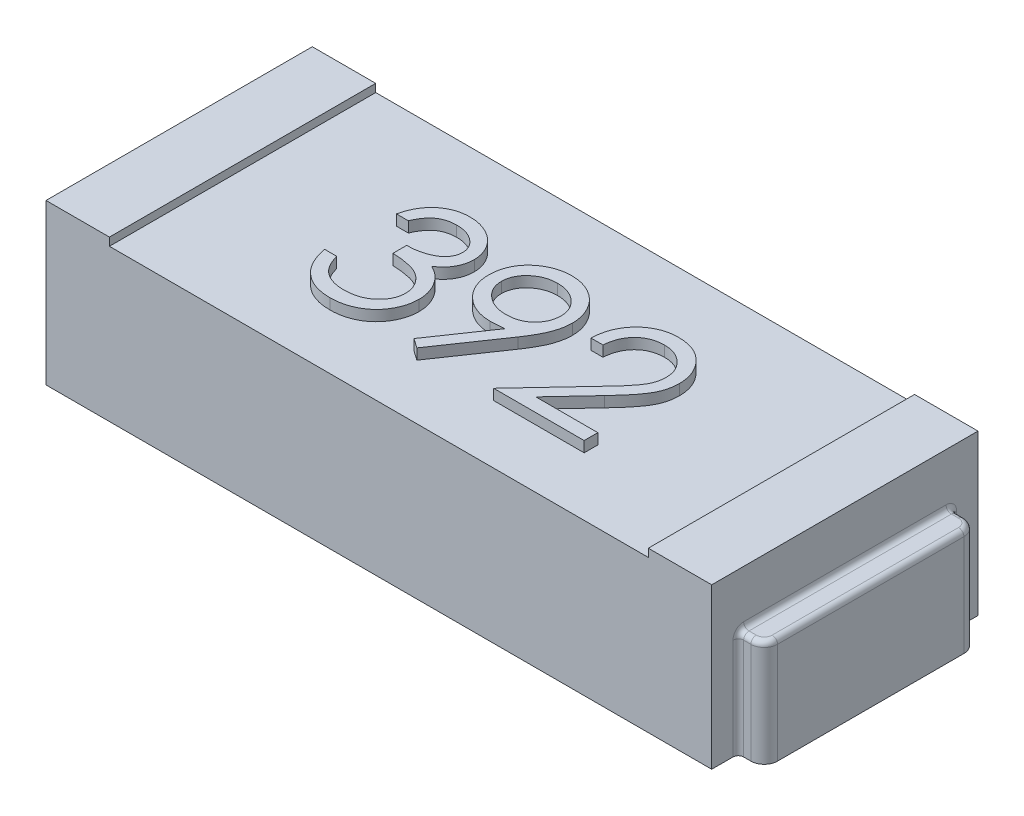
from build123d import *

# Parameters (mm, degrees)
ESQUISSE1_W             = 2.5
ESQUISSE1_H             = 1
BOSS_EXTRU_1_DEPTH      = 0.6
ESQUISSE2_W             = 2.023603034
ESQUISSE2_H             = 1
ENL_V_MAT_EXTRU_1_DEPTH = 0.03
BOSS_EXTRU_2_DEPTH      = 0.4
CONG_1_R                = 0.02
CONG_1_OF_SYM_TRIE2_R   = 0.02
BOSS_EXTRU_3_DEPTH      = 0.04


with BuildPart() as part:
    # Esquisse1 → Boss.-Extru.1 (new body)
    with BuildSketch(Plane(origin=(0, 0, 0), x_dir=(1, 0, 0), z_dir=(0, 1, 0))):
        Rectangle(ESQUISSE1_W, ESQUISSE1_H)
    extrude(amount=BOSS_EXTRU_1_DEPTH)

    # Esquisse2 → Enlèv. mat.-Extru.1 (cut)
    with BuildSketch(Plane(origin=(0, 0.6, 0), x_dir=(1, 0, 0), z_dir=(0, 1, 0))):
        Rectangle(ESQUISSE2_W, ESQUISSE2_H)
    extrude(amount=-ENL_V_MAT_EXTRU_1_DEPTH, mode=Mode.SUBTRACT)

    # Esquisse3 → Boss.-Extru.2 (add)
    with BuildSketch(Plane(origin=(0, 0, 0), x_dir=(1, 0, 0), z_dir=(0, 1, 0))):
        with BuildLine():
            Line((1.25, 0.4), (1.297141448, 0.4))
            ThreePointArc((1.297141448, 0.4), (1.332496787, 0.385355339), (1.347141448, 0.35))
            Line((1.347141448, 0.35), (1.347141448, -0.35))
            ThreePointArc((1.347141448, -0.35), (1.332496787, -0.385355339), (1.297141448, -0.4))
            Line((1.297141448, -0.4), (1.25, -0.4))
            Line((1.25, -0.4), (1.25, 0.4))
        make_face()
    boss_extru_2 = extrude(amount=BOSS_EXTRU_2_DEPTH)

    # Congé1
    cong_1_edges = [part.edges().sort_by_distance(p)[0] for p in [
        (1.25, 0.2, -0.4),
        (1.25, 0.2, 0.4),
        (1.25, 0.4, 0),
        (1.273570724, 0.4, 0.4),
        (1.332496787, 0.4, 0.385355339),
        (1.347141448, 0.4, 0),
        (1.332496787, 0.4, -0.385355339),
        (1.273570724, 0.4, -0.4),
    ]]
    fillet(cong_1_edges, radius=CONG_1_R)

    # Symétrie2: Boss.-Extru.2 across plane
    add(boss_extru_2.mirror(Plane(origin=(0, 0, 0), x_dir=(0, 0, 1), z_dir=(1, 0, 0))))

    # Congé1 of Symétrie2
    cong_1_of_sym_trie2_edges = [part.edges().sort_by_distance(p)[0] for p in [
        (-1.25, 0.2, -0.4),
        (-1.25, 0.2, 0.4),
        (-1.25, 0.4, 0),
        (-1.273570724, 0.4, 0.4),
        (-1.332496787, 0.4, 0.385355339),
        (-1.347141448, 0.4, 0),
        (-1.332496787, 0.4, -0.385355339),
        (-1.273570724, 0.4, -0.4),
    ]]
    fillet(cong_1_of_sym_trie2_edges, radius=CONG_1_OF_SYM_TRIE2_R)

    # Esquisse4 → Boss.-Extru.3 (add)
    # profile 1 of 3: a face of its own
    with BuildSketch(Plane(origin=(0, 0.57, 0), x_dir=(1, 0, 0), z_dir=(0, 1, 0))):
        with BuildLine():
            Line((0.275641026, 0.065854324), (0.230769231, 0.065854324))
            add(Edge.make_bspline(
                [(0.230769231, 0.065854324), (0.231061681, 0.071807307), (0.231636046, 0.08349881), (0.234325802, 0.100545082), (0.238174498, 0.116838625), (0.243616135, 0.132248612), (0.250374174, 0.146911299), (0.258478464, 0.160768444), (0.268077586, 0.173767185), (0.278964262, 0.18578702), (0.290788353, 0.196813816), (0.303546344, 0.206335994), (0.316952777, 0.214381375), (0.330966977, 0.221107267), (0.345747057, 0.226155816), (0.361158894, 0.229901765), (0.377270199, 0.232155528), (0.388247345, 0.232397784), (0.393830128, 0.23252099)],
                knots=[0, 0, 0, 0, 1.10065271, 2.161652631, 3.183658789, 4.190468796, 5.17591951, 6.163126047, 7.15150782, 8.156236427, 9.156009102, 10.134482811, 11.092018607, 12.041330605, 13.001268258, 13.972401359, 14.968799086, 16, 16, 16, 16], degree=3))
            add(Edge.make_bspline(
                [(0.393830128, 0.23252099), (0.39931271, 0.232392639), (0.410085788, 0.232140434), (0.425808933, 0.229974573), (0.440777118, 0.226582346), (0.454961085, 0.221823), (0.468247665, 0.215425225), (0.480736672, 0.207739862), (0.492576787, 0.198851315), (0.503234899, 0.188386485), (0.513021768, 0.177214715), (0.521464947, 0.165287872), (0.528695399, 0.152969403), (0.53472221, 0.140165374), (0.539158802, 0.126755227), (0.542527117, 0.112934198), (0.544431033, 0.098559225), (0.544723237, 0.088829717), (0.544871795, 0.08388317)],
                knots=[0, 0, 0, 0, 1.111607364, 2.184268762, 3.212621178, 4.221274766, 5.211760367, 6.196651075, 7.1921475, 8.207485113, 9.220403448, 10.201281604, 11.166441695, 12.114753415, 13.065576456, 14.026450734, 14.996634279, 16, 16, 16, 16], degree=3))
            add(Edge.make_bspline(
                [(0.544871795, 0.08388317), (0.5446299, 0.076919193), (0.544150356, 0.063113449), (0.540048302, 0.042825611), (0.533641657, 0.023169408), (0.525927749, 0.007349794), (0.518145972, -0.005397848), (0.511133471, -0.015893378), (0.502924212, -0.027194159), (0.493398712, -0.03926235), (0.482754016, -0.052192479), (0.470893707, -0.065976736), (0.45773321, -0.080472703), (0.448496281, -0.090373503), (0.443709936, -0.09550385)],
                knots=[0, 0, 0, 0, 1.184426356, 2.348067706, 3.509069118, 4.696110526, 5.333549288, 6.050745305, 6.844228056, 7.710549037, 8.667450064, 9.695053472, 10.805634456, 12, 12, 12, 12], degree=3))
            Line((0.443709936, -0.09550385), (0.318609776, -0.229017471))
            Line((0.318609776, -0.229017471), (0.551282051, -0.229017471))
            Line((0.551282051, -0.229017471), (0.551282051, -0.280299523))
            Line((0.551282051, -0.280299523), (0.211538462, -0.280299523))
            Line((0.211538462, -0.280299523), (0.405448718, -0.073368433))
            add(Edge.make_bspline(
                [(0.405448718, -0.073368433), (0.410169845, -0.068440103), (0.419238163, -0.058973791), (0.432064245, -0.045153368), (0.443584101, -0.032332005), (0.4538723, -0.020533927), (0.462705658, -0.00958656), (0.470544548, 0.000155541), (0.476825347, 0.009120462), (0.483641832, 0.019511978), (0.490243829, 0.032199452), (0.495917023, 0.047704265), (0.499376287, 0.063665301), (0.499791263, 0.074451306), (0.5, 0.079876759)],
                knots=[0, 0, 0, 0, 1.329631726, 2.553950428, 3.673215718, 4.687767853, 5.603093632, 6.413772471, 7.123043292, 7.734684054, 8.834405432, 9.900288307, 10.943827018, 12, 12, 12, 12], degree=3))
            add(Edge.make_bspline(
                [(0.5, 0.079876759), (0.49990918, 0.083288388), (0.49973019, 0.090012052), (0.498150519, 0.099870018), (0.495763304, 0.109379277), (0.492342553, 0.11856908), (0.487827304, 0.12734703), (0.482331107, 0.135723813), (0.47598967, 0.143822236), (0.468653774, 0.151415565), (0.460594985, 0.158370023), (0.452081521, 0.164530606), (0.443074363, 0.169679051), (0.433611489, 0.17389955), (0.423719279, 0.177210319), (0.413378601, 0.179504402), (0.402618027, 0.180944757), (0.395270385, 0.181139638), (0.391526442, 0.181238939)],
                knots=[0, 0, 0, 0, 0.991446411, 1.95395049, 2.89581595, 3.838931463, 4.798493298, 5.75982156, 6.748411868, 7.785213223, 8.824556874, 9.840280684, 10.836137867, 11.835679398, 12.848801643, 13.863922112, 14.911575587, 16, 16, 16, 16], degree=3))
            add(Edge.make_bspline(
                [(0.391526442, 0.181238939), (0.387616323, 0.181136791), (0.379937495, 0.180936191), (0.368663348, 0.179532953), (0.357908237, 0.177112119), (0.347645108, 0.173801165), (0.337856595, 0.169592801), (0.328590303, 0.164351123), (0.319867034, 0.158096338), (0.311670387, 0.15100483), (0.30411839, 0.143109459), (0.297483122, 0.134308036), (0.291685406, 0.124761262), (0.286626944, 0.114494898), (0.282518988, 0.103415786), (0.279379967, 0.091563257), (0.276896132, 0.078988774), (0.276066343, 0.07030519), (0.275641026, 0.065854324)],
                knots=[0, 0, 0, 0, 1.031018746, 2.02475058, 2.990194455, 3.934040569, 4.864654155, 5.795059489, 6.735614925, 7.690564532, 8.649604399, 9.611025574, 10.590972636, 11.591080095, 12.624614302, 13.701020113, 14.821632451, 16, 16, 16, 16], degree=3))
        make_face()
    # profile 2 of 3: a face of its own
    with BuildSketch(Plane(origin=(0, 0.57, 0), x_dir=(1, 0, 0), z_dir=(0, 1, 0))):
        with BuildLine():
            Line((-0.064102564, -0.293120035), (-0.099959936, -0.268180132))
            Line((-0.099959936, -0.268180132), (0.0390625, -0.064954971))
            add(Edge.make_bspline(
                [(0.0390625, -0.064954971), (0.030192395, -0.066039695), (0.012726663, -0.068175575), (-0.004864351, -0.068567955), (-0.013521635, -0.068761061)],
                knots=[0, 0, 0, 0, 1.015715272, 2, 2, 2, 2], degree=3))
            add(Edge.make_bspline(
                [(-0.013521635, -0.068761061), (-0.018770499, -0.068626622), (-0.02907356, -0.068362729), (-0.044220938, -0.066271042), (-0.058776019, -0.063049595), (-0.072700212, -0.05824263), (-0.086045856, -0.0522686), (-0.098783815, -0.044860455), (-0.110896942, -0.036145271), (-0.122255144, -0.026169129), (-0.132585392, -0.015215122), (-0.14178872, -0.003621458), (-0.149437453, 0.008746538), (-0.155791251, 0.021636569), (-0.160609887, 0.035233905), (-0.164118821, 0.049383819), (-0.166279158, 0.064185482), (-0.166536171, 0.074260501), (-0.166666667, 0.079375958)],
                knots=[0, 0, 0, 0, 1.060718605, 2.082097864, 3.085795603, 4.069760067, 5.054557537, 6.03741023, 7.043284206, 8.066802108, 9.088538119, 10.083643548, 11.053783639, 12.022749082, 12.983451788, 13.964007469, 14.966251758, 16, 16, 16, 16], degree=3))
            add(Edge.make_bspline(
                [(-0.166666667, 0.079375958), (-0.16641889, 0.08637148), (-0.165932555, 0.10010227), (-0.162018482, 0.120164237), (-0.15558129, 0.139133743), (-0.146605808, 0.156960914), (-0.135300848, 0.173389305), (-0.121713906, 0.188190535), (-0.105927626, 0.201154086), (-0.088301623, 0.212297525), (-0.069251191, 0.221259668), (-0.049298526, 0.227865282), (-0.028596509, 0.231750818), (-0.014572556, 0.232263083), (-0.007512019, 0.23252099)],
                knots=[0, 0, 0, 0, 1.022988612, 2.007919123, 2.978103895, 3.94594894, 4.918897164, 5.887013414, 6.875921846, 7.89917871, 8.930658928, 9.948724884, 10.967259574, 12, 12, 12, 12], degree=3))
            add(Edge.make_bspline(
                [(-0.007512019, 0.23252099), (-0.000585102, 0.232259538), (0.013101833, 0.231742934), (0.033228834, 0.22795951), (0.052506122, 0.221582842), (0.070826835, 0.212770762), (0.087789608, 0.201724918), (0.103043295, 0.188562843), (0.116239801, 0.173276339), (0.127357498, 0.156235126), (0.136281789, 0.137925558), (0.142720687, 0.118813569), (0.14668435, 0.099036608), (0.147183825, 0.085637398), (0.147435897, 0.078875157)],
                knots=[0, 0, 0, 0, 1.026385292, 2.028040595, 3.023318987, 4.028184125, 5.03290303, 6.015178782, 7.004435299, 8.016004309, 9.023023918, 10.015172535, 10.998308025, 12, 12, 12, 12], degree=3))
            add(Edge.make_bspline(
                [(0.147435897, 0.078875157), (0.147267553, 0.073626047), (0.146926109, 0.062979541), (0.144535208, 0.046803778), (0.140475182, 0.030310745), (0.135867796, 0.016350517), (0.131420344, 0.004820739), (0.127234468, -0.00428663), (0.122589874, -0.013872524), (0.117172908, -0.02383643), (0.111349723, -0.034305363), (0.104769826, -0.045174323), (0.097583316, -0.056457893), (0.092464784, -0.06406462), (0.08984375, -0.067959779)],
                knots=[0, 0, 0, 0, 1.179839688, 2.393009684, 3.667231171, 4.993948276, 5.694988576, 6.444077775, 7.246288328, 8.089075292, 8.993003841, 9.939041771, 10.944649915, 12, 12, 12, 12], degree=3))
            Line((0.08984375, -0.067959779), (-0.064102564, -0.293120035))
        make_face()
        with BuildLine():
            add(Edge.make_bspline(
                [(-0.005208333, -0.01747901), (-0.001232046, -0.017370384), (0.006508435, -0.017158925), (0.017848049, -0.015871891), (0.028551507, -0.013589893), (0.038647399, -0.010315648), (0.048236957, -0.006364695), (0.057167861, -0.001334412), (0.065447586, 0.004667965), (0.073131575, 0.011412253), (0.079955004, 0.018905193), (0.08603258, 0.026747637), (0.091198375, 0.03497401), (0.095278843, 0.043687333), (0.098633783, 0.052675506), (0.100950641, 0.062083271), (0.102234118, 0.071861614), (0.102452914, 0.078504279), (0.102564103, 0.081879965)],
                knots=[0, 0, 0, 0, 1.163407946, 2.26475976, 3.333800367, 4.359385343, 5.366239384, 6.363380779, 7.350133999, 8.353570782, 9.349036268, 10.310270964, 11.253520213, 12.184142, 13.120487599, 14.056272588, 15.012232024, 16, 16, 16, 16], degree=3))
            add(Edge.make_bspline(
                [(0.102564103, 0.081879965), (0.102468436, 0.08525706), (0.102279912, 0.09191204), (0.100767441, 0.10170486), (0.098106694, 0.111089611), (0.094536625, 0.120117673), (0.089833734, 0.128714869), (0.084190379, 0.136989136), (0.077485743, 0.144888011), (0.069771091, 0.152225723), (0.061451869, 0.158989709), (0.052586083, 0.164959148), (0.04324681, 0.169962176), (0.033491025, 0.174090601), (0.023298404, 0.177312283), (0.012674977, 0.179629049), (0.001567062, 0.180910728), (-0.005973122, 0.181128142), (-0.009815705, 0.181238939)],
                knots=[0, 0, 0, 0, 0.972161553, 1.915763587, 2.844109794, 3.775983486, 4.705125789, 5.659731448, 6.655561913, 7.682237399, 8.721216875, 9.739758359, 10.754845918, 11.767244016, 12.7857855, 13.828538656, 14.893392813, 16, 16, 16, 16], degree=3))
            add(Edge.make_bspline(
                [(-0.009815705, 0.181238939), (-0.01362487, 0.181127963), (-0.02109842, 0.180910229), (-0.032107585, 0.179631485), (-0.042659181, 0.177296702), (-0.052822269, 0.174092093), (-0.062577764, 0.169961868), (-0.071916597, 0.164958886), (-0.080784457, 0.158991083), (-0.089095702, 0.152220401), (-0.096823977, 0.144922166), (-0.103413338, 0.136954533), (-0.109069609, 0.128719173), (-0.113766038, 0.120116529), (-0.117337826, 0.111089916), (-0.119998112, 0.101704777), (-0.121510707, 0.091912061), (-0.121699213, 0.085257067), (-0.121794872, 0.081879965)],
                knots=[0, 0, 0, 0, 1.099389452, 2.15699305, 3.192601482, 4.213358962, 5.227959689, 6.245255729, 7.266013209, 8.307253147, 9.336162325, 10.327954924, 11.284637477, 12.215801273, 13.149702402, 14.080068371, 15.025723358, 16, 16, 16, 16], degree=3))
            add(Edge.make_bspline(
                [(-0.121794872, 0.081879965), (-0.121708311, 0.07850165), (-0.121537597, 0.071838997), (-0.11989077, 0.062049512), (-0.11713673, 0.052665484), (-0.113448246, 0.043595669), (-0.108590876, 0.034928261), (-0.102630326, 0.026704352), (-0.095643819, 0.018830716), (-0.08772475, 0.011429686), (-0.079057869, 0.004636518), (-0.069801191, -0.001296394), (-0.060114072, -0.006306743), (-0.04996241, -0.010326941), (-0.039421439, -0.013557178), (-0.02839642, -0.015867685), (-0.016923815, -0.01714658), (-0.00915096, -0.017367137), (-0.005208333, -0.01747901)],
                knots=[0, 0, 0, 0, 0.952633368, 1.87876736, 2.791047057, 3.707742249, 4.635551637, 5.587206343, 6.568248508, 7.601284464, 8.641511608, 9.671105535, 10.699146789, 11.713763218, 12.747829548, 13.806491675, 14.887386225, 16, 16, 16, 16], degree=3))
        make_face(mode=Mode.SUBTRACT)
    # profile 3 of 3: a face of its own
    with BuildSketch(Plane(origin=(0, 0.57, 0), x_dir=(1, 0, 0), z_dir=(0, 1, 0))):
        with BuildLine():
            Line((-0.493589744, 0.104315862), (-0.538461538, 0.104315862))
            add(Edge.make_bspline(
                [(-0.538461538, 0.104315862), (-0.537245888, 0.109349074), (-0.534869392, 0.119188592), (-0.529912596, 0.133246772), (-0.524512702, 0.146550132), (-0.518028544, 0.158849571), (-0.510955865, 0.170392272), (-0.502852619, 0.180916432), (-0.494092659, 0.190689713), (-0.48440338, 0.199363033), (-0.474242143, 0.207216994), (-0.463465769, 0.213913431), (-0.45229107, 0.219674024), (-0.440640622, 0.224419771), (-0.42847974, 0.227994846), (-0.415918366, 0.230588676), (-0.40292358, 0.23227312), (-0.394102495, 0.232437515), (-0.389623397, 0.23252099)],
                knots=[0, 0, 0, 0, 1.162005537, 2.271625781, 3.343758855, 4.383309926, 5.390229558, 6.379919256, 7.361854164, 8.333198761, 9.295911338, 10.242430842, 11.177959212, 12.116337295, 13.062827104, 14.020064771, 14.994644689, 16, 16, 16, 16], degree=3))
            add(Edge.make_bspline(
                [(-0.389623397, 0.23252099), (-0.383097291, 0.232323957), (-0.370187433, 0.231934189), (-0.351221283, 0.228374984), (-0.332931738, 0.222742822), (-0.315518988, 0.214960861), (-0.299344926, 0.205362674), (-0.284954042, 0.19393914), (-0.272541398, 0.180910668), (-0.262127915, 0.166520302), (-0.253974344, 0.151140943), (-0.247962005, 0.13531235), (-0.244301765, 0.119072068), (-0.2438274, 0.108106742), (-0.243589744, 0.102613138)],
                knots=[0, 0, 0, 0, 1.083050992, 2.142477498, 3.193116406, 4.255571735, 5.30263384, 6.308962982, 7.297363603, 8.282367274, 9.249857812, 10.179914175, 11.08814088, 12, 12, 12, 12], degree=3))
            add(Edge.make_bspline(
                [(-0.243589744, 0.102613138), (-0.243755971, 0.097326453), (-0.244081252, 0.086981231), (-0.24684321, 0.07187816), (-0.251491247, 0.057643645), (-0.257929785, 0.044217765), (-0.266264292, 0.031685645), (-0.276360392, 0.020019089), (-0.288289343, 0.009166352), (-0.297329192, 0.002949285), (-0.301983173, -0.000251446)],
                knots=[0, 0, 0, 0, 1.024540389, 2.004866551, 2.965041327, 3.920577974, 4.882998113, 5.874504559, 6.905732034, 8, 8, 8, 8], degree=3))
            add(Edge.make_bspline(
                [(-0.301983173, -0.000251446), (-0.296664351, -0.002819756), (-0.286126226, -0.007908321), (-0.271761865, -0.017887715), (-0.258722168, -0.029410051), (-0.251450208, -0.038401858), (-0.247796474, -0.042919715)],
                knots=[0, 0, 0, 0, 1.015518401, 2.012035669, 3.001164323, 4, 4, 4, 4], degree=3))
            add(Edge.make_bspline(
                [(-0.247796474, -0.042919715), (-0.245390568, -0.046213679), (-0.240618155, -0.052747668), (-0.234727364, -0.063252871), (-0.229383205, -0.073874513), (-0.225218888, -0.084897285), (-0.22199405, -0.09619343), (-0.219688902, -0.107782343), (-0.218256882, -0.119673489), (-0.218051803, -0.127718129), (-0.217948718, -0.131761862)],
                knots=[0, 0, 0, 0, 1.025084078, 2.033381695, 3.024893161, 4.013698104, 4.991890475, 5.976764909, 6.982997093, 8, 8, 8, 8], degree=3))
            add(Edge.make_bspline(
                [(-0.217948718, -0.131761862), (-0.218205077, -0.138763251), (-0.218716589, -0.15273308), (-0.223288599, -0.173372326), (-0.230376205, -0.193547398), (-0.240441482, -0.212843803), (-0.252708269, -0.230898143), (-0.267302172, -0.247051902), (-0.284057373, -0.260937417), (-0.302743895, -0.272538878), (-0.322989199, -0.281812867), (-0.344642855, -0.288249644), (-0.367392862, -0.29244193), (-0.382993905, -0.292891483), (-0.390925481, -0.293120035)],
                knots=[0, 0, 0, 0, 0.955779014, 1.907060117, 2.875433937, 3.871313158, 4.872415639, 5.851225146, 6.836215519, 7.83643374, 8.849228613, 9.86973379, 10.916971861, 12, 12, 12, 12], degree=3))
            add(Edge.make_bspline(
                [(-0.390925481, -0.293120035), (-0.396271095, -0.292996005), (-0.406789482, -0.292751954), (-0.422252838, -0.291083583), (-0.437013081, -0.288036439), (-0.451090167, -0.283935967), (-0.4644966, -0.278737147), (-0.477191473, -0.272263047), (-0.489252886, -0.264647118), (-0.500567022, -0.255799463), (-0.511132531, -0.245902128), (-0.520668635, -0.234779413), (-0.52933432, -0.222636926), (-0.536897554, -0.209333633), (-0.543702833, -0.195041453), (-0.549300112, -0.179577382), (-0.554226622, -0.163079664), (-0.556517117, -0.151582844), (-0.557692308, -0.145684138)],
                knots=[0, 0, 0, 0, 1.048658725, 2.063410685, 3.046034179, 4.001477787, 4.936774919, 5.862367409, 6.792675028, 7.730719943, 8.675894397, 9.627829632, 10.600096036, 11.597688215, 12.626045268, 13.701542398, 14.82072376, 16, 16, 16, 16], degree=3))
            Line((-0.557692308, -0.145684138), (-0.512820513, -0.145684138))
            add(Edge.make_bspline(
                [(-0.512820513, -0.145684138), (-0.511651471, -0.149533997), (-0.509377584, -0.157022307), (-0.50550697, -0.167799494), (-0.501097217, -0.177679216), (-0.496366565, -0.186733947), (-0.491398216, -0.195052862), (-0.485838941, -0.202415986), (-0.480100492, -0.209146729), (-0.47577487, -0.212938817), (-0.473657853, -0.214794715)],
                knots=[0, 0, 0, 0, 1.198163088, 2.33053128, 3.407730985, 4.417276592, 5.372219308, 6.28897303, 7.162600585, 8, 8, 8, 8], degree=3))
            add(Edge.make_bspline(
                [(-0.473657853, -0.214794715), (-0.470858342, -0.216953048), (-0.465267961, -0.221263053), (-0.456158214, -0.226763286), (-0.446577516, -0.231529146), (-0.436318277, -0.235169674), (-0.425601881, -0.238252197), (-0.414255114, -0.240269414), (-0.402378083, -0.241653439), (-0.394268403, -0.241775572), (-0.390124199, -0.241837984)],
                knots=[0, 0, 0, 0, 0.946170439, 1.889420265, 2.845303464, 3.807233317, 4.801018734, 5.828864929, 6.890507805, 8, 8, 8, 8], degree=3))
            add(Edge.make_bspline(
                [(-0.390124199, -0.241837984), (-0.385445127, -0.241749998), (-0.376295606, -0.241577948), (-0.362944912, -0.239995704), (-0.350243848, -0.237691359), (-0.33833343, -0.234132362), (-0.327057643, -0.229735097), (-0.31657455, -0.224213896), (-0.306746535, -0.217736079), (-0.297699477, -0.210373342), (-0.289564405, -0.202313128), (-0.282401617, -0.19388269), (-0.27631238, -0.185117571), (-0.27140044, -0.175969268), (-0.26752179, -0.166475664), (-0.264881333, -0.156610117), (-0.263045402, -0.146453365), (-0.262895886, -0.139549226), (-0.262820513, -0.136068753)],
                knots=[0, 0, 0, 0, 1.217147791, 2.380027433, 3.494444702, 4.572153297, 5.609568379, 6.639424714, 7.649109417, 8.668170816, 9.669597737, 10.625200337, 11.543417969, 12.441394052, 13.322311151, 14.205496177, 15.095365482, 16, 16, 16, 16], degree=3))
            add(Edge.make_bspline(
                [(-0.262820513, -0.136068753), (-0.263039127, -0.131409991), (-0.263475269, -0.122115647), (-0.266805066, -0.108441707), (-0.272282046, -0.095266934), (-0.279949548, -0.082816107), (-0.289283223, -0.071276693), (-0.300192496, -0.060980767), (-0.312767957, -0.052485039), (-0.324342224, -0.046615231), (-0.334594389, -0.042609935), (-0.343368016, -0.039942083), (-0.353190387, -0.037682989), (-0.363942723, -0.035581236), (-0.37570604, -0.033792472), (-0.388467531, -0.032300784), (-0.402229782, -0.031107207), (-0.411757092, -0.030574193), (-0.416666667, -0.030299523)],
                knots=[0, 0, 0, 0, 1.07054697, 2.135767047, 3.216561865, 4.33974944, 5.486079747, 6.621378074, 7.775625952, 8.963672916, 9.598146892, 10.304877434, 11.070270905, 11.915000392, 12.823868403, 13.805723172, 14.86925407, 16, 16, 16, 16], degree=3))
            Line((-0.416666667, -0.030299523), (-0.416666667, 0.020982529))
            add(Edge.make_bspline(
                [(-0.416666667, 0.020982529), (-0.410480786, 0.021087501), (-0.398364165, 0.021293115), (-0.380664979, 0.023779974), (-0.36374022, 0.027220063), (-0.347964971, 0.032489376), (-0.333586583, 0.038609419), (-0.321112354, 0.045731163), (-0.310717048, 0.053647556), (-0.30245118, 0.062480786), (-0.296232719, 0.071954364), (-0.291686034, 0.081828172), (-0.289000273, 0.092188752), (-0.288641749, 0.099259419), (-0.288461538, 0.102813458)],
                knots=[0, 0, 0, 0, 1.321986639, 2.589447074, 3.816329219, 5.01088745, 6.139805852, 7.153945165, 8.075214402, 8.924034688, 9.728124013, 10.488707548, 11.240355623, 12, 12, 12, 12], degree=3))
            add(Edge.make_bspline(
                [(-0.288461538, 0.102813458), (-0.28852074, 0.105424565), (-0.288638519, 0.110619237), (-0.290123844, 0.118208533), (-0.29235585, 0.125565811), (-0.295424383, 0.132659783), (-0.299531554, 0.139441251), (-0.304446695, 0.14596803), (-0.310299281, 0.152202855), (-0.317005773, 0.158014329), (-0.32420746, 0.163552792), (-0.332100285, 0.16825474), (-0.340446267, 0.172275463), (-0.349254646, 0.175591106), (-0.358554007, 0.17808529), (-0.368300658, 0.179876125), (-0.378513185, 0.18099579), (-0.385480575, 0.181156992), (-0.389022436, 0.181238939)],
                knots=[0, 0, 0, 0, 0.884392785, 1.759457502, 2.611959086, 3.489218968, 4.37281399, 5.2945488, 6.255912374, 7.266815255, 8.301784654, 9.332968512, 10.37626691, 11.440494194, 12.520033166, 13.637162961, 14.798855837, 16, 16, 16, 16], degree=3))
            add(Edge.make_bspline(
                [(-0.389022436, 0.181238939), (-0.394715531, 0.181040173), (-0.405835471, 0.180651937), (-0.421866173, 0.177251506), (-0.436768935, 0.171826066), (-0.448160173, 0.16534992), (-0.45657197, 0.158957001), (-0.462582961, 0.153373803), (-0.468485891, 0.147169114), (-0.473892416, 0.139960774), (-0.479360127, 0.132236947), (-0.484337922, 0.123604993), (-0.48917502, 0.114290079), (-0.49208967, 0.107704989), (-0.493589744, 0.104315862)],
                knots=[0, 0, 0, 0, 1.472543308, 2.876219568, 4.221790263, 5.565193594, 6.249813518, 6.953379497, 7.687249741, 8.463570142, 9.283606569, 10.136032583, 11.040678096, 12, 12, 12, 12], degree=3))
        make_face()
    extrude(amount=BOSS_EXTRU_3_DEPTH)


solid = part.part
